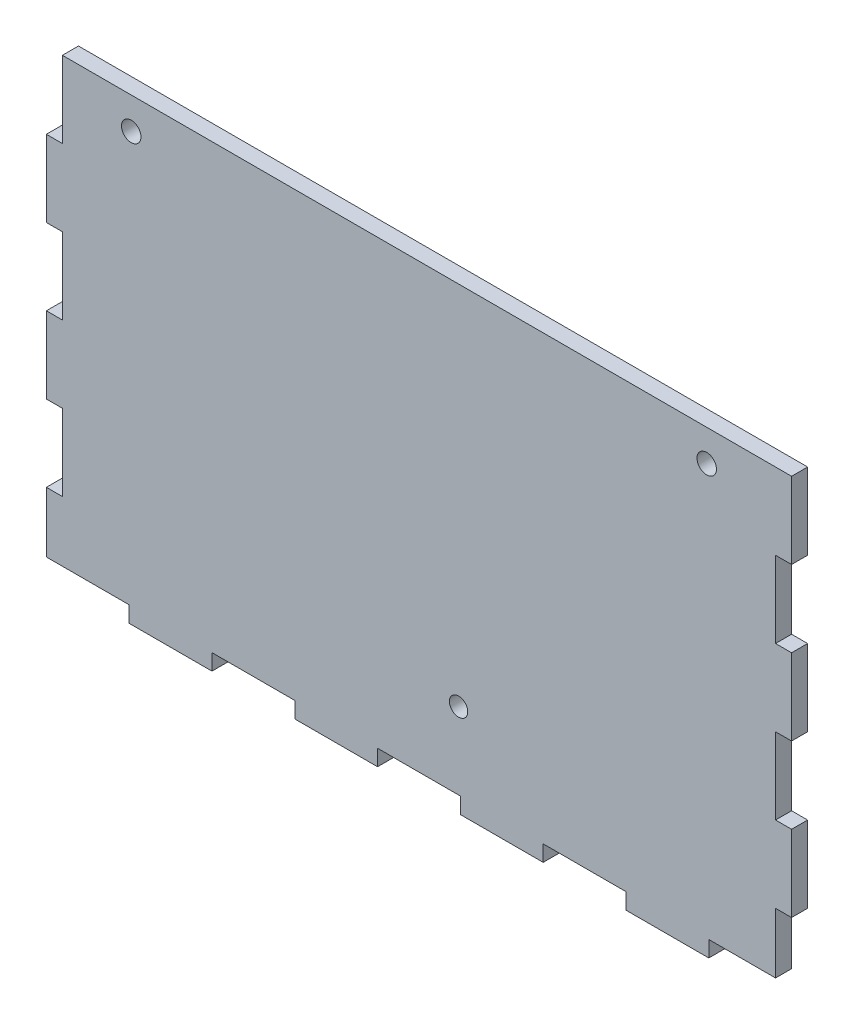
from build123d import *

# Parameters (mm, degrees)
SKETCH1_W                = 130
SKETCH1_H                = 80
BOSS_EXTRUDE1_DEPTH      = 2.8
SKETCH2_W                = 14.444444444
SKETCH2_H                = 2.8
SKETCH2_W_2              = 2.8
SKETCH2_H_2              = 13.333333334
SKETCH2_H_3              = 13.333333333
CUT_EXTRUDE1_DEPTH       = 153.669053839
CUT_EXTRUDE2_REACH       = 154.669
SKETCH3_R                = 1.7
TUNING_DRIVER_HOLE_REACH = 154.669
SKETCH4_R                = 1.6


with BuildPart() as part:
    # Sketch1 → Boss-Extrude1 (new body)
    with BuildSketch(Plane.XY):
        with Locations((65, 40)):
            Rectangle(SKETCH1_W, SKETCH1_H)
    extrude(amount=BOSS_EXTRUDE1_DEPTH)

    # Sketch2 → Cut-Extrude1 (cut, through all)
    with BuildSketch(Plane.XY.offset(2.8)):
        with Locations((7.222222222, 1.4)):
            Rectangle(SKETCH2_W, SKETCH2_H)
        with Locations((36.111111111, 1.4)):
            Rectangle(SKETCH2_W, SKETCH2_H)
        with Locations((65, 1.4)):
            Rectangle(SKETCH2_W, SKETCH2_H)
        with Locations((93.888888889, 1.4)):
            Rectangle(SKETCH2_W, SKETCH2_H)
        Polygon((115.555555556, 0), (115.555555556, 2.8), (127.2, 2.8), (127.2, 13.333333333), (130, 13.333333333), (130, 0), align=None)
        with Locations((1.4, 20)):
            Rectangle(SKETCH2_W_2, SKETCH2_H_2)
        with Locations((1.4, 46.666666667)):
            Rectangle(SKETCH2_W_2, SKETCH2_H_3)
        with Locations((1.4, 73.333333334)):
            Rectangle(SKETCH2_W_2, SKETCH2_H_3)
        with Locations((128.6, 33.333333334)):
            Rectangle(SKETCH2_W_2, SKETCH2_H_3)
        with Locations((128.6, 60)):
            Rectangle(SKETCH2_W_2, SKETCH2_H_2)
    extrude(amount=-CUT_EXTRUDE1_DEPTH, mode=Mode.SUBTRACT)

    # Sketch3 → Cut-Extrude2 (cut, up to next)
    with BuildSketch(Plane.XY.offset(2.8), mode=Mode.PRIVATE) as cut_extrude2_sk1:
        with Locations((14.8, 74.5)):
            Circle(SKETCH3_R)
    cut_extrude2_tool1 = extrude(cut_extrude2_sk1.sketch, amount=-CUT_EXTRUDE2_REACH, mode=Mode.PRIVATE) & part.part
    # Sketch3 → Cut-Extrude2 (cut, up to next)
    with BuildSketch(Plane.XY.offset(2.8), mode=Mode.PRIVATE) as cut_extrude2_sk2:
        with Locations(Location((115.2, 74.5, 0), (0, 0, 180))):
            Circle(SKETCH3_R)
    cut_extrude2_tool2 = extrude(cut_extrude2_sk2.sketch, amount=-CUT_EXTRUDE2_REACH, mode=Mode.PRIVATE) & part.part
    add(cut_extrude2_tool1.solids().sort_by_distance((14.8, 74.5, 2.8))[0], mode=Mode.SUBTRACT)
    add(cut_extrude2_tool2.solids().sort_by_distance((115.2, 74.5, 2.8))[0], mode=Mode.SUBTRACT)

    # Sketch4 → Tuning driver hole (cut, up to next)
    with BuildSketch(Plane(origin=(0, 0, 0), x_dir=(-1, 0, 0), z_dir=(0, 0, -1)), mode=Mode.PRIVATE) as tuning_driver_hole_sk1:
        with Locations((-71.91, 16.16)):
            Circle(SKETCH4_R)
    tuning_driver_hole_tool1 = extrude(tuning_driver_hole_sk1.sketch, amount=-TUNING_DRIVER_HOLE_REACH, mode=Mode.PRIVATE) & part.part
    add(tuning_driver_hole_tool1.solids().sort_by_distance((71.91, 16.16, 0))[0], mode=Mode.SUBTRACT)


solid = part.part
